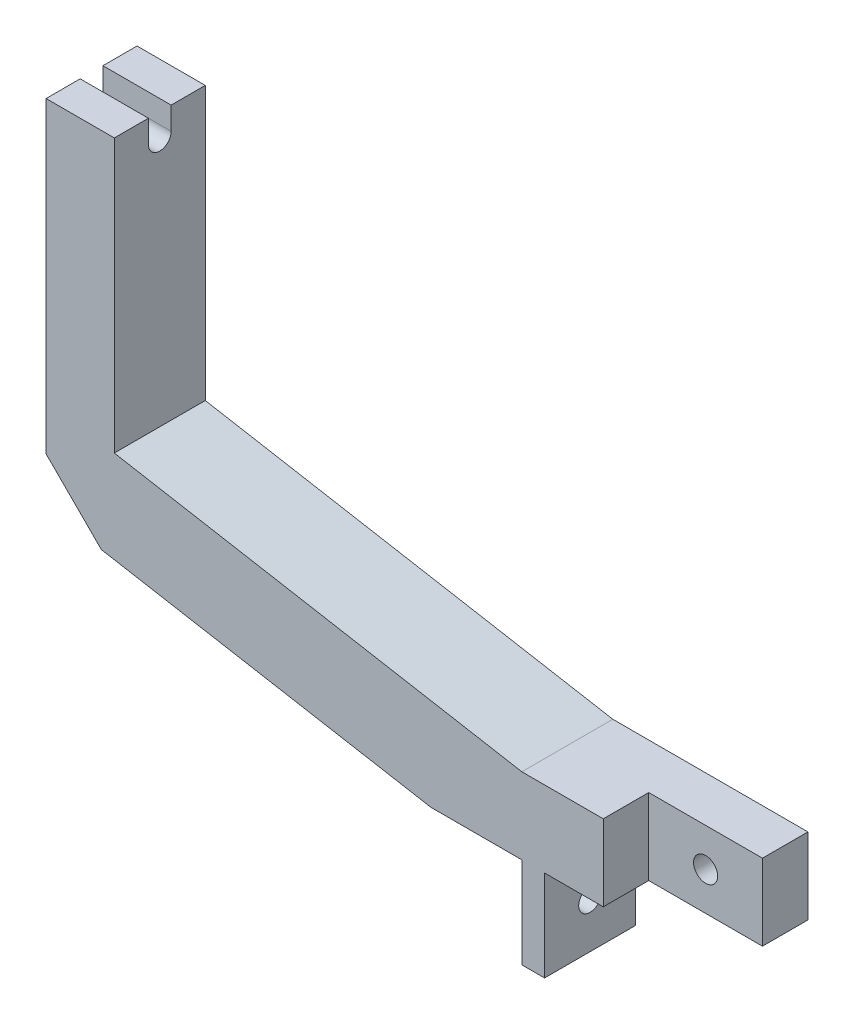
from build123d import *
from OCP.BRepFilletAPI import BRepFilletAPI_MakeChamfer

# Parameters (mm, degrees)
BOSS_EXTRUDE1_DEPTH     = 25.4
CUT_EXTRUDE1_DEPTH      = 364.416353858
CUT_EXTRUDE1_DEPTH_BACK = 364.416353858
CUT_EXTRUDE2_DEPTH      = 243.106174261
CUT_EXTRUDE2_DEPTH_BACK = 243.106174261
SKETCH3_R               = 3.175
CHAMFER1_SIZE           = 12.7
CHAMFER1_SIZE2          = 15.677839289
CUT_EXTRUDE3_DEPTH      = 199.314331311
CUT_EXTRUDE3_DEPTH_BACK = 199.314331311
CUT_EXTRUDE4_DEPTH      = 209.332111666
CUT_EXTRUDE4_DEPTH_BACK = 209.332111666
SKETCH5_R               = 3.3655


with BuildPart() as part:
    # Sketch1 → Boss-Extrude1 (new body)
    with BuildSketch(Plane.XY):
        Polygon((32.258, 0), (-32.258, 0), (-32.258, -25.4), (-38.608, -25.4), (-38.608, 0), (-64.008, 0), (-171.45, 19.05), (-171.45, 117.668501525), (-152.4, 117.668501525), (-152.4, 41.468501525), (-38.608, 21.292615), (38.608, 21.292615), (152.4, 41.468501525), (152.4, 117.668501525), (171.45, 117.668501525), (171.45, 19.05), (64.008, 0), (38.608, 0), (38.608, -25.4), (32.258, -25.4), align=None)
    extrude(amount=BOSS_EXTRUDE1_DEPTH)

    # Sketch2 → Cut-Extrude1 (cut, two sides: drawn at the far end of the back side and taken through both)
    with BuildSketch(Plane(origin=(171.45, 0, 0), x_dir=(0, 0, -1), z_dir=(1, 0, 0)).offset(-CUT_EXTRUDE1_DEPTH_BACK)):
        with BuildLine():
            Line((-15.875, 117.668501525), (-9.525, 117.668501525))
            Line((-9.525, 117.668501525), (-9.525, 111.318501525))
            ThreePointArc((-9.525, 111.318501525), (-12.7, 108.143501525), (-15.875, 111.318501525))
            Line((-15.875, 111.318501525), (-15.875, 117.668501525))
        make_face()
    extrude(amount=CUT_EXTRUDE1_DEPTH + CUT_EXTRUDE1_DEPTH_BACK, mode=Mode.SUBTRACT)

    # Sketch3 → Cut-Extrude2 (cut, two sides: drawn at the far end of the back side and taken through both)
    with BuildSketch(Plane(origin=(38.608, 0, 0), x_dir=(0, 0, -1), z_dir=(1, 0, 0)).offset(-CUT_EXTRUDE2_DEPTH_BACK)):
        with Locations((-12.7, -12.7)):
            Circle(SKETCH3_R)
    extrude(amount=CUT_EXTRUDE2_DEPTH + CUT_EXTRUDE2_DEPTH_BACK, mode=Mode.SUBTRACT)

    # Chamfer1: one chamfer whose edges measure the first distance from different faces: ONE call of the kernel's chamfer builder (chamfer() names one face for all edges)
    chamfer1_edges_1 = [part.edges().sort_by_distance(p)[0] for p in [
        (-171.45, 19.05, 12.7),
    ]]
    chamfer1_side_1 = [part.faces().sort_by_distance(p)[0] for p in [
        (-171.45, 67.330500984, 12.7),
    ]]
    chamfer1_edges_2 = [part.edges().sort_by_distance(p)[0] for p in [
        (171.45, 19.05, 12.7),
    ]]
    chamfer1_side_2 = [part.faces().sort_by_distance(p)[0] for p in [
        (117.729, 9.525, 12.7),
    ]]
    chamfer1 = BRepFilletAPI_MakeChamfer(part.part.solid().wrapped)
    for e in chamfer1_edges_1:
        chamfer1.Add(CHAMFER1_SIZE, CHAMFER1_SIZE2, e.wrapped, chamfer1_side_1[0].wrapped)  # the first distance lies on this face
    for e in chamfer1_edges_2:
        chamfer1.Add(CHAMFER1_SIZE, CHAMFER1_SIZE2, e.wrapped, chamfer1_side_2[0].wrapped)  # the first distance lies on this face
    add(Compound.cast(chamfer1.Shape()), mode=Mode.REPLACE)

    # Sketch4 → Cut-Extrude3 (cut, two sides: drawn at the far end of the back side and taken through both)
    with BuildSketch(Plane(origin=(0, 21.292615, 0), x_dir=(1, 0, 0), z_dir=(0, 1, 0)).offset(-CUT_EXTRUDE3_DEPTH_BACK)):
        Polygon((15.875, 0), (15.875, -12.7), (-15.875, -12.7), (-15.875, -25.4), (141.747764855, -83.64087264), (246.478777591, -63.978728487), (187.893613379, 40.752284248), align=None)
    extrude(amount=CUT_EXTRUDE3_DEPTH + CUT_EXTRUDE3_DEPTH_BACK, mode=Mode.SUBTRACT)

    # Sketch5 → Cut-Extrude4 (cut, two sides: drawn at the far end of the back side and taken through both)
    with BuildSketch(Plane.XY.offset(12.7).offset(-CUT_EXTRUDE4_DEPTH_BACK)):
        with Locations((0, 10.6463075)):
            Circle(SKETCH5_R)
    extrude(amount=CUT_EXTRUDE4_DEPTH + CUT_EXTRUDE4_DEPTH_BACK, mode=Mode.SUBTRACT)


solid = part.part
